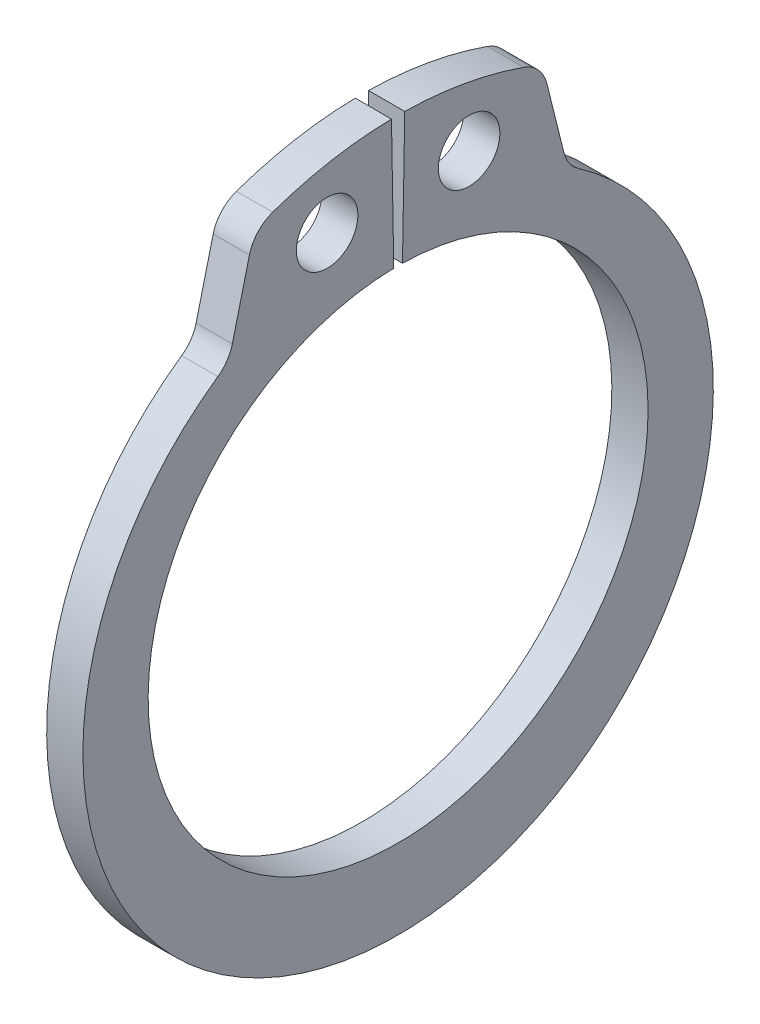
from build123d import *

# Parameters (mm, degrees)
SKETCH1_R      = 0.85
EXTRUDE1_DEPTH = 0.5
FILLET1_R      = 1


with BuildPart() as part:
    # Sketch1 → Extrude1 (new, symmetric)
    with BuildSketch(Plane(origin=(0, 0, 0), x_dir=(0, 0, -1), z_dir=(1, 0, 0))):
        with BuildLine():
            Line((-0.120421604, 6.898949097), (-0.183250268, 10.498400799))
            ThreePointArc((-0.183250268, 10.498400799), (-2.11687985, 10.284396905), (-3.977840048, 9.717344727))
            Line((-3.977840048, 9.717344727), (-4.669754883, 6.9422259))
            ThreePointArc((-4.669754883, 6.9422259), (0, -9.1), (4.669754883, 6.9422259))
            Line((4.669754883, 6.9422259), (3.977840048, 9.717344727))
            ThreePointArc((3.977840048, 9.717344727), (2.11687985, 10.284396905), (0.183250268, 10.498400799))
            Line((0.183250268, 10.498400799), (0.120421604, 6.898949097))
            ThreePointArc((0.120421604, 6.898949097), (0, -6.9), (-0.120421604, 6.898949097))
        make_face()
        with Locations((-1.959628832, 8.667119805)):
            Circle(SKETCH1_R, mode=Mode.SUBTRACT)
        with Locations((1.959628832, 8.667119805)):
            Circle(SKETCH1_R, mode=Mode.SUBTRACT)
    extrude(amount=EXTRUDE1_DEPTH, both=True)

    # Fillet1
    fillet1_edges = [part.edges().sort_by_distance(p)[0] for p in [
        (0, 9.717344727, -3.977840048),
        (0, 6.9422259, -4.669754883),
        (0, 6.9422259, 4.669754883),
        (0, 9.717344727, 3.977840048),
    ]]
    fillet(fillet1_edges, radius=FILLET1_R)


solid = part.part
